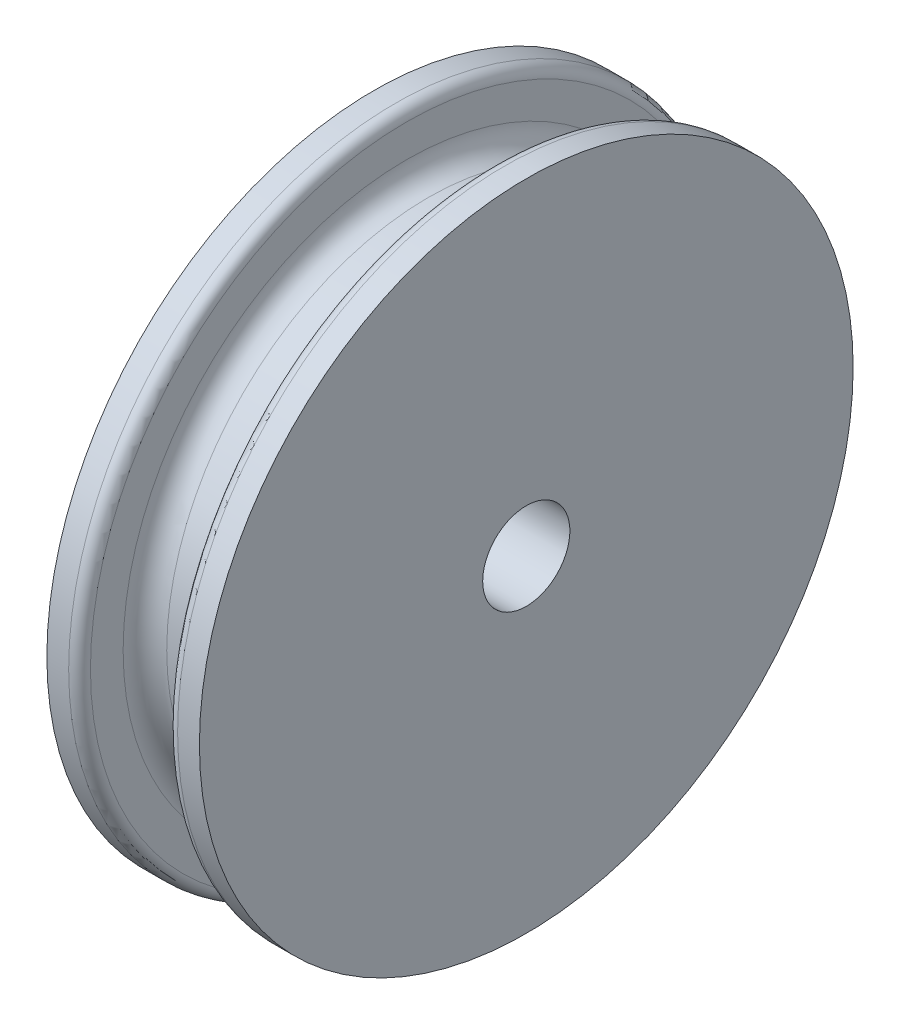
from build123d import *

# Parameters (mm, degrees)
FILLET1_R = 0.25


with BuildPart() as part:
    # Sketch1 → Revolve1 (revolve)
    with BuildSketch(Plane.XY, mode=Mode.PRIVATE) as revolve1_sk:
        with BuildLine():
            Line((-1.75, 1), (1.75, 1))
            Line((1.75, 1), (1.75, 7.5))
            Line((1.75, 7.5), (1, 7.5))
            Line((1, 7.5), (1, 6.5))
            ThreePointArc((1, 6.5), (0.853553391, 6.146446609), (0.5, 6))
            Line((0.5, 6), (-0.5, 6))
            ThreePointArc((-0.5, 6), (-0.853553391, 6.146446609), (-1, 6.5))
            Line((-1, 6.5), (-1, 7.5))
            Line((-1, 7.5), (-1.75, 7.5))
            Line((-1.75, 7.5), (-1.75, 1))
        make_face()
    revolve(revolve1_sk.sketch.rotate(Axis((0, 0, 0), (1, 0, 0)), 90), axis=Axis((0, 0, 0), (1, 0, 0)))

    # Fillet1
    fillet1_edges = [part.edges().sort_by_distance(p)[0] for p in [
        (1, 0, -7.5),
        (-1, 0, -7.5),
    ]]
    fillet(fillet1_edges, radius=FILLET1_R)


solid = part.part
